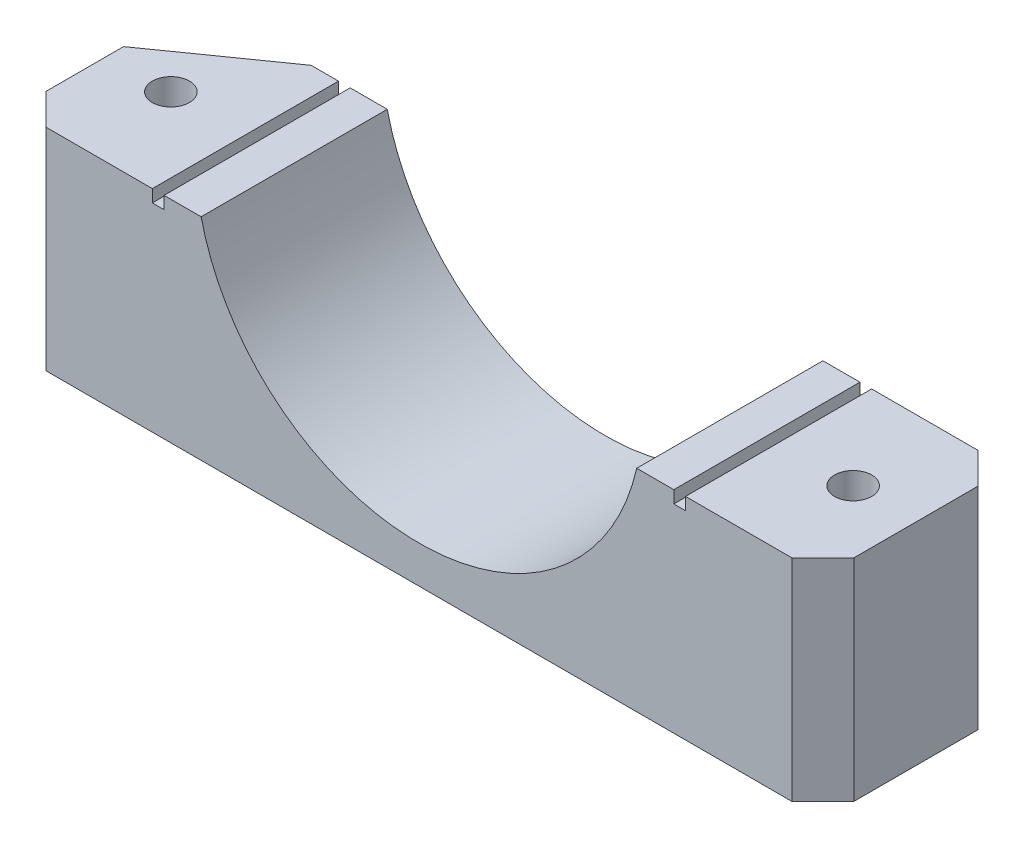
from build123d import *

# Parameters (mm, degrees)
BOSS_EXTRUDE1_DEPTH = 15
CHAMFER1_SIZE       = 2.5
SKETCH2_R           = 1.5
CUT_EXTRUDE1_DEPTH  = 40.667340007
SKETCH3_W           = 0.942684348
SKETCH3_H           = 15
CUT_EXTRUDE2_DEPTH  = 1
CUT_EXTRUDE3_DEPTH  = 25


with BuildPart() as part:
    # Sketch1 → Boss-Extrude1 (new body)
    with BuildSketch(Plane.XY):
        with BuildLine():
            Line((-17.549928775, -4), (-32.549928775, -4))
            Line((-32.549928775, -4), (-32.549928775, -21))
            Line((-32.549928775, -21), (32.549928775, -21))
            Line((32.549928775, -21), (32.549928775, -4))
            Line((32.549928775, -4), (17.549928775, -4))
            ThreePointArc((17.549928775, -4), (0, -18), (-17.549928775, -4))
        make_face()
    extrude(amount=BOSS_EXTRUDE1_DEPTH)

    # Chamfer1
    chamfer1_edges = [part.edges().sort_by_distance(p)[0] for p in [
        (-32.549928775, -12.5, 15),
        (32.549928775, -12.5, 15),
        (32.549928775, -12.5, 0),
    ]]
    chamfer(chamfer1_edges, length=CHAMFER1_SIZE)

    # Sketch2 → Cut-Extrude1 (cut, through all)
    with BuildSketch(Plane(origin=(0, -4, 0), x_dir=(1, 0, 0), z_dir=(0, 1, 0))):
        with Locations(Location((27.488644481, -7.5, 0), (0, 0, 180))):
            Circle(SKETCH2_R)
        with Locations((-27.488644481, -7.5)):
            Circle(SKETCH2_R)
    extrude(amount=-CUT_EXTRUDE1_DEPTH, mode=Mode.SUBTRACT)

    # Sketch3 → Cut-Extrude2 (cut)
    with BuildSketch(Plane(origin=(0, -4, 0), x_dir=(1, 0, 0), z_dir=(0, 1, 0))):
        with Locations((-21.008394031, -7.5)):
            Rectangle(SKETCH3_W, SKETCH3_H)
    cut_extrude2 = extrude(amount=-CUT_EXTRUDE2_DEPTH, mode=Mode.SUBTRACT)

    # Mirror1: Cut-Extrude2 across plane
    add(cut_extrude2.mirror(Plane(origin=(0, 0, 0), x_dir=(0, 0, 1), z_dir=(1, 0, 0))), mode=Mode.SUBTRACT)

    # Sketch4 → Cut-Extrude3 (cut)
    with BuildSketch(Plane.XZ.offset(21)):
        Polygon((-23.68309692, 0), (-32.549928775, 6.25), (-32.549928775, 0), align=None)
    extrude(amount=-CUT_EXTRUDE3_DEPTH, mode=Mode.SUBTRACT)


solid = part.part
